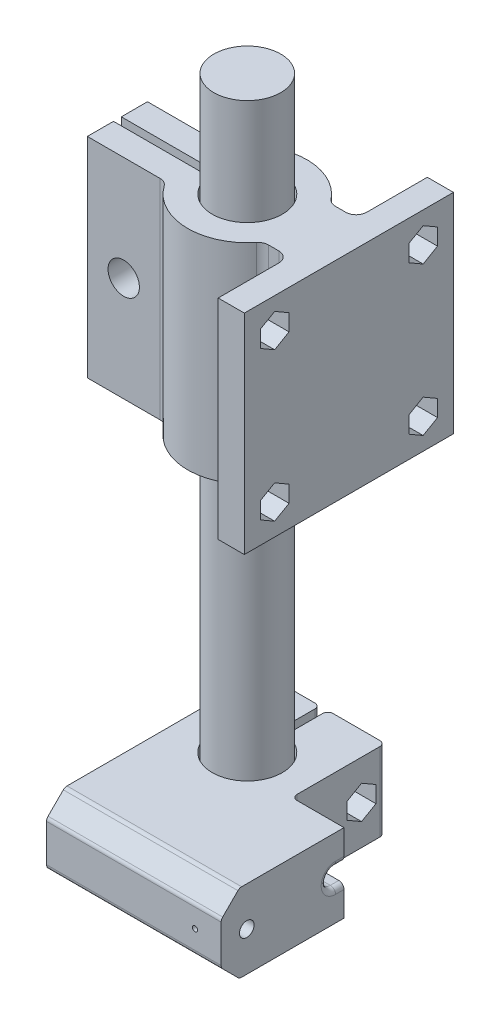
from build123d import *

# Parameters (mm, degrees)
BOSS_EXTRUDE1_DEPTH      = 40
BOSS_EXTRUDE1_DEPTH_BACK = 80
SKETCH1_R                = 6.4
BOSS_EXTRUDE2_DEPTH      = 20
BOSS_EXTRUDE2_DEPTH_BACK = 20
SKETCH6_W                = 40
SKETCH6_H                = 40
BOSS_EXTRUDE6_DEPTH      = 10
BOSS_EXTRUDE7_DEPTH      = 20
BOSS_EXTRUDE7_DEPTH_BACK = 20
FILLET4_R                = 2
FILLET5_R                = 2
CUT_EXTRUDE1_REACH       = 107.462
SKETCH9_R                = 3
CUT_EXTRUDE2_REACH       = 101.861
SKETCH10_R               = 2.5
BOSS_EXTRUDE8_DEPTH      = 7.5
BOSS_EXTRUDE8_DEPTH_BACK = 7.5
FILLET6_R                = 1
FILLET7_R                = 1
CUT_EXTRUDE8_REACH       = 120.558
SKETCH17_R               = 1.55
CUT_EXTRUDE9_DEPTH       = 5
SKETCH19_R               = 6.4
BOSS_EXTRUDE9_DEPTH      = 10
BOSS_EXTRUDE11_DEPTH     = 10
CUT_EXTRUDE15_DEPTH      = 23.4
SKETCH29_R               = 0.5
CUT_EXTRUDE16_DEPTH      = 23.5
SKETCH30_R               = 1.75
CUT_EXTRUDE17_DEPTH      = 8
FILLET10_R               = 1
SKETCH31_R               = 1.4
CUT_EXTRUDE18_DEPTH      = 5
CUT_EXTRUDE19_DEPTH      = 5
FILLET11_R               = 1
SKETCH33_R               = 1.5
CUT_EXTRUDE20_DEPTH      = 10
CUT_EXTRUDE21_DEPTH      = 5
SKETCH35_W               = 76.564023034
SKETCH35_H               = 53.794597286
CUT_EXTRUDE22_DEPTH      = 68


with BuildPart() as part:
    # Sketch1 → Boss-Extrude1 (new, two sides: drawn at the far end of the back side and taken through both)
    with BuildSketch(Plane(origin=(0, 0, 0), x_dir=(1, 0, 0), z_dir=(0, 1, 0)).offset(-BOSS_EXTRUDE1_DEPTH_BACK)):
        with Locations(Location((0, 0, 0), (0, 0, 270))):
            Circle(SKETCH1_R)
    extrude(amount=BOSS_EXTRUDE1_DEPTH + BOSS_EXTRUDE1_DEPTH_BACK)

    # Sketch19 → Boss-Extrude9 (add)
    with BuildSketch(Plane(origin=(0, -80, 0), x_dir=(-1, 0, 0), z_dir=(0, -1, 0))):
        with Locations(Location((0, 0, 0), (0, 0, 270))):
            Circle(SKETCH19_R)
    extrude(amount=BOSS_EXTRUDE9_DEPTH)


with BuildPart() as body_2:
    # Sketch2 → Boss-Extrude2 (new, two sides: drawn at the far end of the back side and taken through both)
    with BuildSketch(Plane(origin=(0, 0, 0), x_dir=(1, 0, 0), z_dir=(0, 1, 0)).offset(-BOSS_EXTRUDE2_DEPTH_BACK)):
        with BuildLine():
            Line((-9.843652777, 5.75), (-24.843652777, 5.75))
            Line((-24.843652777, 5.75), (-24.843652777, 0.75))
            Line((-24.843652777, 0.75), (-6.657890056, 0.75))
            ThreePointArc((-6.657890056, 0.75), (6.7, 0), (-6.657890056, -0.75))
            Line((-6.657890056, -0.75), (-24.843652777, -0.75))
            Line((-24.843652777, -0.75), (-24.843652777, -5.75))
            Line((-24.843652777, -5.75), (-9.843652777, -5.75))
            ThreePointArc((-9.843652777, -5.75), (-0.384164957, -11.393525235), (9.433981132, -6.4))
            Line((9.433981132, -6.4), (14.433981132, -6.4))
            Line((14.433981132, -6.4), (14.433981132, 6.4))
            Line((14.433981132, 6.4), (9.433981132, 6.4))
            ThreePointArc((9.433981132, 6.4), (-0.384164957, 11.393525235), (-9.843652777, 5.75))
        make_face()
    extrude(amount=BOSS_EXTRUDE2_DEPTH + BOSS_EXTRUDE2_DEPTH_BACK)

    # Sketch6 → Boss-Extrude6 (add)
    with BuildSketch(Plane(origin=(14.433981132, 0, 0), x_dir=(0, 0, -1), z_dir=(1, 0, 0))):
        Rectangle(SKETCH6_W, SKETCH6_H)
    extrude(amount=BOSS_EXTRUDE6_DEPTH)

    # Sketch7 → Boss-Extrude7 (add, two sides: drawn at the far end of the back side and taken through both)
    with BuildSketch(Plane(origin=(0, 0, 0), x_dir=(-1, 0, 0), z_dir=(0, 0, -1)).offset(-BOSS_EXTRUDE7_DEPTH_BACK)):
        with BuildLine():
            Line((-24.433981132, -6.4), (-29.433981132, -6.4))
            ThreePointArc((-29.433981132, -6.4), (-39.252127221, -11.393525235), (-48.711615041, -5.75))
            Line((-48.711615041, -5.75), (-63.711615041, -5.75))
            Line((-63.711615041, -5.75), (-63.711615041, -0.75))
            Line((-63.711615041, -0.75), (-45.52585232, -0.75))
            ThreePointArc((-45.52585232, -0.75), (-32.167962264, 0), (-45.52585232, 0.75))
            Line((-45.52585232, 0.75), (-63.711615041, 0.75))
            Line((-63.711615041, 0.75), (-63.711615041, 5.75))
            Line((-63.711615041, 5.75), (-48.711615041, 5.75))
            ThreePointArc((-48.711615041, 5.75), (-39.252127221, 11.393525235), (-29.433981132, 6.4))
            Line((-29.433981132, 6.4), (-24.433981132, 6.4))
            Line((-24.433981132, 6.4), (-24.433981132, -6.4))
        make_face()
    extrude(amount=BOSS_EXTRUDE7_DEPTH + BOSS_EXTRUDE7_DEPTH_BACK)

    # Fillet4
    fillet4_edges = [body_2.edges().sort_by_distance(p)[0] for p in [
        (24.433981132, 6.4, 0),
        (24.433981132, -6.4, 0),
        (14.433981132, 0, -6.4),
        (14.433981132, 0, 6.4),
    ]]
    fillet(fillet4_edges, radius=FILLET4_R)

    # Fillet5
    fillet5_edges = [body_2.edges().sort_by_distance(p)[0] for p in [
        (29.433981132, -6.4, 0),
        (29.433981132, 6.4, 0),
        (48.711615041, 5.75, 0),
        (48.711615041, -5.75, 0),
        (9.433981132, 0, 6.4),
        (9.433981132, 0, -6.4),
        (-9.843652777, 0, -5.75),
        (-9.843652777, 0, 5.75),
    ]]
    fillet(fillet5_edges, radius=FILLET5_R)

    # Cut-Extrude1: up to this face of the body (flat: up to its plane)
    cut_extrude1_end = Plane(body_2.part.faces().sort_by_distance((-17.887571992, 0, -5.75))[0])
    # Sketch9 → Cut-Extrude1 (cut, up to the picked face)
    with BuildSketch(Plane.XY.offset(5.75), mode=Mode.PRIVATE) as cut_extrude1_sk1:
        with Locations((-17.887571992, 0)):
            Circle(SKETCH9_R)
    cut_extrude1_tool1 = split(extrude(cut_extrude1_sk1.sketch, amount=-CUT_EXTRUDE1_REACH, mode=Mode.PRIVATE), bisect_by=cut_extrude1_end, keep=Keep.BOTH, mode=Mode.PRIVATE)
    add(cut_extrude1_tool1.solids().sort_by(Axis((-17.887572, 0, 5.75), (0, 0, -1)))[0], mode=Mode.SUBTRACT)

    # Cut-Extrude2: up to this face of the body (flat: up to its plane)
    cut_extrude2_end = Plane(body_2.part.faces().sort_by_distance((56.755534256, 5.75, 0))[0])
    # Sketch10 → Cut-Extrude2 (cut, up to the picked face)
    with BuildSketch(Plane(origin=(0, -5.75, 0), x_dir=(-1, 0, 0), z_dir=(0, -1, 0)), mode=Mode.PRIVATE) as cut_extrude2_sk1:
        with Locations(Location((-56.755534256, 0, 0), (0, 0, 180))):
            Circle(SKETCH10_R)
    cut_extrude2_tool1 = split(extrude(cut_extrude2_sk1.sketch, amount=-CUT_EXTRUDE2_REACH, mode=Mode.PRIVATE), bisect_by=cut_extrude2_end, keep=Keep.BOTH, mode=Mode.PRIVATE)
    add(cut_extrude2_tool1.solids().sort_by(Axis((56.755534, -5.75, 0), (0, 1, 0)))[0], mode=Mode.SUBTRACT)

    # Sketch33 → Cut-Extrude20 (cut)
    with BuildSketch(Plane.ZY.offset(-14.433981132)):
        with Locations((14.2, 14.2)):
            Circle(SKETCH33_R)
        with Locations(Location((14.2, -14.2, 0), (0, 0, 180))):
            Circle(SKETCH33_R)
        with Locations((-14.2, -14.2)):
            Circle(SKETCH33_R)
        with Locations(Location((-14.2, 14.2, 0), (0, 0, 180))):
            Circle(SKETCH33_R)
    extrude(amount=-CUT_EXTRUDE20_DEPTH, mode=Mode.SUBTRACT)

    # Sketch34 → Cut-Extrude21 (cut)
    with BuildSketch(Plane.ZY.offset(-14.433981132)):
        Polygon((16.95, -12.61228676), (16.95, -15.78771324), (14.2, -17.375426481), (11.45, -15.78771324), (11.45, -12.61228676), (14.2, -11.024573519), align=None)
        Polygon((14.2, 17.375426481), (16.95, 15.78771324), (16.95, 12.61228676), (14.2, 11.024573519), (11.45, 12.61228676), (11.45, 15.78771324), align=None)
        Polygon((-14.2, -17.375426481), (-16.95, -15.78771324), (-16.95, -12.61228676), (-14.2, -11.024573519), (-11.45, -12.61228676), (-11.45, -15.78771324), align=None)
        Polygon((-16.95, 12.61228676), (-16.95, 15.78771324), (-14.2, 17.375426481), (-11.45, 15.78771324), (-11.45, 12.61228676), (-14.2, 11.024573519), align=None)
    extrude(amount=-CUT_EXTRUDE21_DEPTH, mode=Mode.SUBTRACT)

    # Sketch35 → Cut-Extrude22 (cut)
    with BuildSketch(Plane.ZY.offset(-19.433981132)):
        Rectangle(SKETCH35_W, SKETCH35_H)
    extrude(amount=-CUT_EXTRUDE22_DEPTH, mode=Mode.SUBTRACT)


with BuildPart() as body_3:
    # Sketch13 → Boss-Extrude8 (new, two sides: drawn at the far end of the back side and taken through both)
    with BuildSketch(Plane.XZ.offset(80).offset(-BOSS_EXTRUDE8_DEPTH_BACK)):
        with BuildLine():
            Line((11.7, -14.657890056), (11.7, 26.7))
            Line((11.7, 26.7), (-11.7, 26.7))
            Line((-11.7, 26.7), (-11.7, -14.657890056))
            Line((-11.7, -14.657890056), (-0.75, -14.657890056))
            Line((-0.75, -14.657890056), (-0.75, -6.657890056))
            ThreePointArc((-0.75, -6.657890056), (0, 6.7), (0.75, -6.657890056))
            Line((0.75, -6.657890056), (0.75, -14.657890056))
            Line((0.75, -14.657890056), (11.7, -14.657890056))
        make_face()
    extrude(amount=BOSS_EXTRUDE8_DEPTH + BOSS_EXTRUDE8_DEPTH_BACK)

    # Fillet6
    fillet6_edges = [body_3.edges().sort_by_distance(p)[0] for p in [
        (-11.7, -80, -14.657890056),
        (11.7, -80, -14.657890056),
    ]]
    fillet(fillet6_edges, radius=FILLET6_R)

    # Fillet7
    fillet7_edges = [body_3.edges().sort_by_distance(p)[0] for p in [
        (0.75, -80, -14.657890056),
        (-0.75, -80, -14.657890056),
    ]]
    fillet(fillet7_edges, radius=FILLET7_R)

    # Cut-Extrude8: up to this face of the body (flat: up to its plane)
    cut_extrude8_end = Plane(body_3.part.faces().sort_by_distance((11.7, -80, 6.521054972))[0])
    # Sketch17 → Cut-Extrude8 (cut, up to the picked face)
    with BuildSketch(Plane.ZY.offset(11.7), mode=Mode.PRIVATE) as cut_extrude8_sk1:
        with Locations((-10.157890056, -80)):
            Circle(SKETCH17_R)
    cut_extrude8_tool1 = split(extrude(cut_extrude8_sk1.sketch, amount=-CUT_EXTRUDE8_REACH, mode=Mode.PRIVATE), bisect_by=cut_extrude8_end, keep=Keep.BOTH, mode=Mode.PRIVATE)
    add(cut_extrude8_tool1.solids().sort_by(Axis((-11.7, -80, -10.15789), (1, 0, 0)))[0], mode=Mode.SUBTRACT)

    # Sketch18 → Cut-Extrude9 (cut)
    with BuildSketch(Plane(origin=(11.7, 0, 0), x_dir=(0, 0, -1), z_dir=(1, 0, 0))):
        Polygon((12.907890056, -78.41228676), (12.907890056, -81.58771324), (10.157890056, -83.175426481), (7.407890056, -81.58771324), (7.407890056, -78.41228676), (10.157890056, -76.824573519), align=None)
    extrude(amount=-CUT_EXTRUDE9_DEPTH, mode=Mode.SUBTRACT)

    # Sketch27 → Boss-Extrude11 (add)
    with BuildSketch(Plane(origin=(11.7, 0, 0), x_dir=(0, 0, -1), z_dir=(1, 0, 0))):
        Polygon((-23.2, -72.5), (-26.7, -76), (-26.7, -84), (-23.2, -87.5), (-3.2, -87.5), (-3.2, -72.5), align=None)
    extrude(amount=BOSS_EXTRUDE11_DEPTH)

    # Sketch28 → Cut-Extrude15 (cut)
    with BuildSketch(Plane(origin=(11.7, 0, 0), x_dir=(0, 0, -1), z_dir=(1, 0, 0))):
        Polygon((-26.7, -72.5), (-26.7, -76), (-23.2, -72.5), align=None)
        Polygon((-26.7, -87.5), (-23.2, -87.5), (-26.7, -84), align=None)
    extrude(amount=-CUT_EXTRUDE15_DEPTH, mode=Mode.SUBTRACT)

    # Sketch29 → Cut-Extrude16 (cut)
    with BuildSketch(Plane(origin=(0, 0, 3.2), x_dir=(-1, 0, 0), z_dir=(0, 0, -1))):
        with Locations(Location((-16.7, -80, 0), (0, 0, 90))):
            Circle(SKETCH29_R)
    extrude(amount=-CUT_EXTRUDE16_DEPTH, mode=Mode.SUBTRACT)

    # Sketch30 → Cut-Extrude17 (cut)
    with BuildSketch(Plane(origin=(0, 0, 3.2), x_dir=(-1, 0, 0), z_dir=(0, 0, -1))):
        with Locations(Location((-16.7, -80, 0), (0, 0, 90))):
            Circle(SKETCH30_R)
    extrude(amount=-CUT_EXTRUDE17_DEPTH, mode=Mode.SUBTRACT)

    # Fillet10
    fillet10_edges = [body_3.edges().sort_by_distance(p)[0] for p in [
        (5, -72.5, 23.2),
        (5, -76, 26.7),
        (5, -84, 26.7),
        (5, -87.5, 23.2),
        (11.7, -80, 3.2),
    ]]
    fillet(fillet10_edges, radius=FILLET10_R)

    # Sketch31 → Cut-Extrude18 (cut)
    with BuildSketch(Plane(origin=(21.7, 0, 0), x_dir=(0, 0, -1), z_dir=(1, 0, 0))):
        with Locations((-21.796919258, -80)):
            Circle(SKETCH31_R)
    extrude(amount=-CUT_EXTRUDE18_DEPTH, mode=Mode.SUBTRACT)

    # Sketch32 → Cut-Extrude19 (cut)
    with BuildSketch(Plane(origin=(21.7, 0, 0), x_dir=(0, 0, -1), z_dir=(1, 0, 0))):
        with BuildLine():
            Line((-1.387428393, -81.75), (-4.818925736, -81.75))
            ThreePointArc((-4.818925736, -81.75), (-6.568925736, -80), (-4.818925736, -78.25))
            Line((-4.818925736, -78.25), (-1.387428393, -78.25))
            ThreePointArc((-1.387428393, -78.25), (0.362571607, -80), (-1.387428393, -81.75))
        make_face()
    extrude(amount=-CUT_EXTRUDE19_DEPTH, mode=Mode.SUBTRACT)

    # Fillet11
    fillet11_edges = [body_3.edges().sort_by_distance(p)[0] for p in [
        (21.7, -81.75, 4.009462868),
        (21.7, -78.25, 4.009462868),
        (21.7, -80, 6.568925736),
    ]]
    fillet(fillet11_edges, radius=FILLET11_R)


solid = Compound([part.part, body_2.part, body_3.part])
